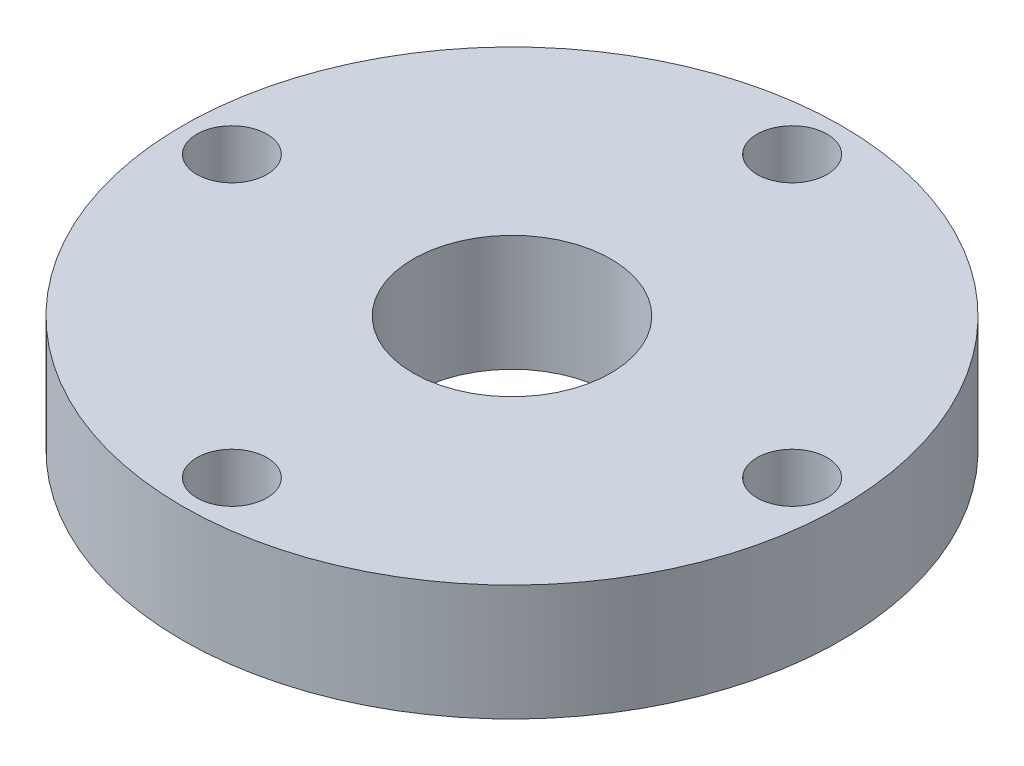
from build123d import *

# Parameters (mm, degrees)
SKETCH1_W                                         = 22.352
SKETCH1_H                                         = 63.5
CUT_EXTRUDE2_START                                = 11.176
SKETCH2_R                                         = 19.05
CUT_EXTRUDE2_DEPTH                                = 102.671320188
CBORE_FOR_5_16_SOCKET_HEAD_CAP_SCREW1_D           = 8.7376
CBORE_FOR_5_16_SOCKET_HEAD_CAP_SCREW1_DEPTH       = 22.352
CBORE_FOR_5_16_SOCKET_HEAD_CAP_SCREW1_CBORE_D     = 13.4874
CBORE_FOR_5_16_SOCKET_HEAD_CAP_SCREW1_CBORE_DEPTH = 9.652
CBORE_FOR_5_16_SOCKET_HEAD_CAP_SCREW1_TIP         = 2.625039872


with BuildPart() as part:
    # Sketch1 → Revolve1 (revolve)
    with BuildSketch(Plane(origin=(0, 0, 0), x_dir=(0, 1, 0), z_dir=(0, 0, 1)), mode=Mode.PRIVATE) as revolve1_sk:
        with Locations((0, 31.75)):
            Rectangle(SKETCH1_W, SKETCH1_H)
    revolve(revolve1_sk.sketch.rotate(Axis((0, -36.576, 0), (0, 1, 0)), 270), axis=Axis((0, -36.576, 0), (0, 1, 0)))

    # Sketch2 → Cut-Extrude2 (cut, through all)
    with BuildSketch(Plane(origin=(0, 0, 0), x_dir=(-1, 0, 0), z_dir=(0, 1, 0)).offset(CUT_EXTRUDE2_START)):
        with Locations(Location((0, 0, 0), (0, 0, 90))):
            Circle(SKETCH2_R)
    extrude(amount=-CUT_EXTRUDE2_DEPTH, mode=Mode.SUBTRACT)

    # CBORE for 5/16 Socket Head Cap Screw1
    with Locations(Plane(origin=(0, 11.176, 0), x_dir=(1, 0, 0), z_dir=(0, 1, 0))):
        with Locations((-53.975, 0), (0, -53.975), (53.975, 0), (0, 53.975)):
            CounterBoreHole(CBORE_FOR_5_16_SOCKET_HEAD_CAP_SCREW1_D / 2, CBORE_FOR_5_16_SOCKET_HEAD_CAP_SCREW1_CBORE_D / 2, CBORE_FOR_5_16_SOCKET_HEAD_CAP_SCREW1_CBORE_DEPTH, depth=CBORE_FOR_5_16_SOCKET_HEAD_CAP_SCREW1_DEPTH)
            with Locations((0, 0, -(CBORE_FOR_5_16_SOCKET_HEAD_CAP_SCREW1_DEPTH + CBORE_FOR_5_16_SOCKET_HEAD_CAP_SCREW1_TIP / 2))):  # 118° drill point
                Cone(0, CBORE_FOR_5_16_SOCKET_HEAD_CAP_SCREW1_D / 2, CBORE_FOR_5_16_SOCKET_HEAD_CAP_SCREW1_TIP, mode=Mode.SUBTRACT)


solid = part.part
